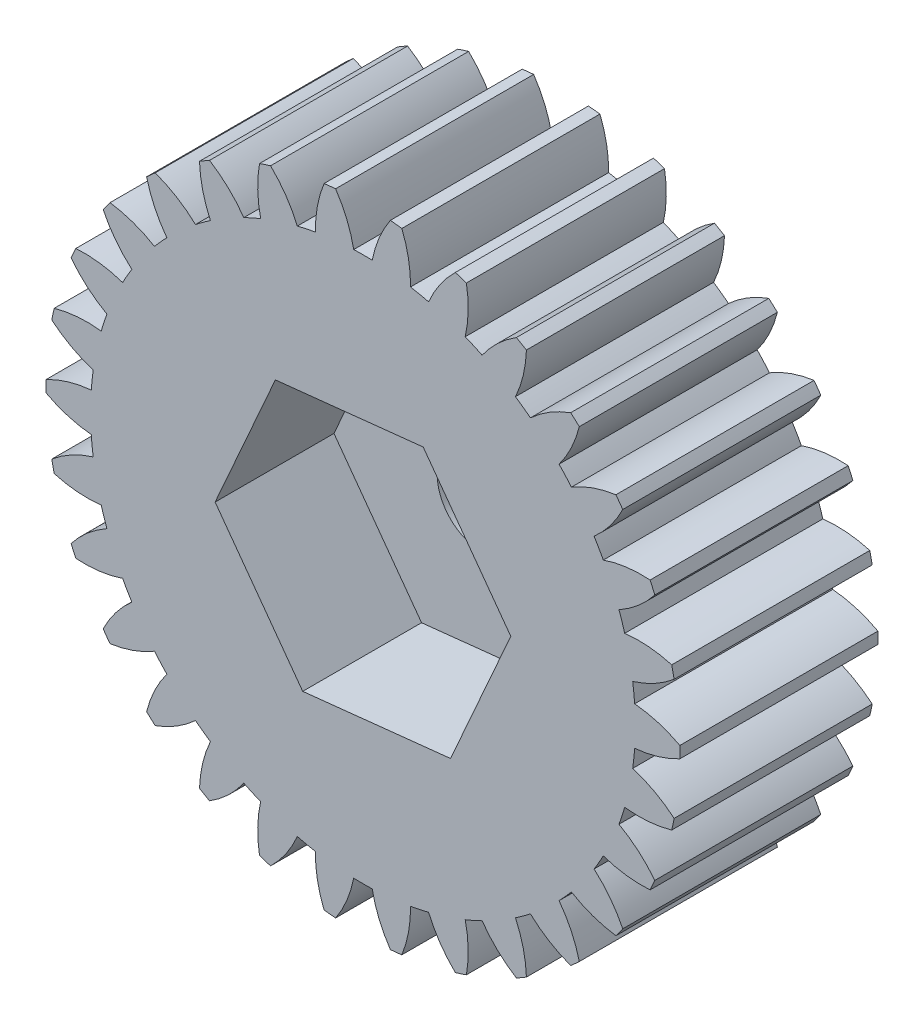
from build123d import *

# Parameters (mm, degrees)
BOSS_EXTRUDE1_DEPTH = 10
SKETCH2_R           = 2.25
CUT_EXTRUDE1_DEPTH  = 10
CUT_EXTRUDE2_DEPTH  = 6


with BuildPart() as part:
    # Sketch1 → Boss-Extrude1 (new body)
    with BuildSketch(Plane.XY):
        with BuildLine():
            ThreePointArc((13.714564017, 1.835617176), (14.890017219, 2.061122256), (15.997323333, 2.515452466))
            ThreePointArc((15.997323333, 2.515452466), (16, 2.808106158), (15.997323333, 3.10075985))
            ThreePointArc((15.997323333, 3.10075985), (14.890017219, 3.555090061), (13.714564017, 3.78059514))
            ThreePointArc((13.714564017, 3.78059514), (13.673681539, 4.245268), (13.617059717, 4.708286587))
            ThreePointArc((13.617059717, 4.708286587), (14.719941304, 5.173254302), (15.70858956, 5.847878195))
            ThreePointArc((15.70858956, 5.847878195), (15.650361612, 6.134693211), (15.586897312, 6.420395207))
            ThreePointArc((15.586897312, 6.420395207), (14.409327931, 6.634575326), (13.21267606, 6.610762116))
            ThreePointArc((13.21267606, 6.610762116), (13.076076043, 7.056780814), (12.924424565, 7.497908996))
            ThreePointArc((12.924424565, 7.497908996), (13.90653332, 8.182018026), (14.733315045, 9.047451298))
            ThreePointArc((14.733315045, 9.047451298), (14.616727322, 9.315892447), (14.495249085, 9.582156199))
            ThreePointArc((14.495249085, 9.582156199), (13.29888187, 9.546825528), (12.133330757, 9.27473478))
            ThreePointArc((12.133330757, 9.27473478), (11.906983277, 9.682606158), (11.666930042, 10.082564516))
            ThreePointArc((11.666930042, 10.082564516), (12.485343098, 10.955916014), (13.114123965, 11.974335079))
            ThreePointArc((13.114123965, 11.974335079), (12.94427191, 12.212670195), (12.770088917, 12.447858699))
            ThreePointArc((12.770088917, 12.447858699), (11.607210855, 12.164561357), (10.523700679, 11.656084742))
            ThreePointArc((10.523700679, 11.656084742), (10.217498205, 12.007982865), (9.899534691, 12.349291299))
            ThreePointArc((9.899534691, 12.349291299), (10.518483472, 13.373715614), (10.921782738, 14.500610672))
            ThreePointArc((10.921782738, 14.500610672), (10.706089702, 14.698423366), (10.486814585, 14.892257757))
            ThreePointArc((10.486814585, 14.892257757), (9.408249029, 14.373375197), (8.454134382, 13.650735583))
            ThreePointArc((8.454134382, 13.650735583), (8.081459434, 13.931280814), (7.699482172, 14.199022508))
            ThreePointArc((7.699482172, 14.199022508), (8.091915645, 15.329747381), (8.252107198, 16.515867711))
            ThreePointArc((8.252107198, 16.515867711), (8, 16.664512619), (7.745216135, 16.808521403))
            ThreePointArc((7.745216135, 16.808521403), (6.798101574, 16.076731284), (6.015081845, 15.17151149))
            ThreePointArc((6.015081845, 15.17151149), (5.592222106, 15.368442655), (5.162925335, 15.550916013))
            ThreePointArc((5.162925335, 15.550916013), (5.311692275, 16.738523342), (5.221774975, 17.932029793))
            ThreePointArc((5.221774975, 17.932029793), (4.94427191, 18.025010419), (4.665114574, 18.112899721))
            ThreePointArc((4.665114574, 18.112899721), (3.890844459, 17.200184782), (3.313141369, 16.151947257))
            ThreePointArc((3.313141369, 16.151947257), (2.858577837, 16.256657521), (2.400723887, 16.34588758))
            ThreePointArc((2.400723887, 16.34588758), (2.299322464, 17.538473225), (1.963226128, 18.687203839))
            ThreePointArc((1.963226128, 18.687203839), (1.672455412, 18.720456484), (1.38112512, 18.748385121))
            ThreePointArc((1.38112512, 18.748385121), (0.813538771, 17.694635384), (0.466400716, 16.549193137))
            ThreePointArc((0.466400716, 16.549193137), (0, 16.557106158), (-0.466400716, 16.549193137))
            ThreePointArc((-0.466400716, 16.549193137), (-0.813538771, 17.694635384), (-1.38112512, 18.748385121))
            ThreePointArc((-1.38112512, 18.748385121), (-1.672455412, 18.720456484), (-1.963226128, 18.687203839))
            ThreePointArc((-1.963226128, 18.687203839), (-2.299322464, 17.538473225), (-2.400723887, 16.34588758))
            ThreePointArc((-2.400723887, 16.34588758), (-2.858577837, 16.256657521), (-3.313141369, 16.151947257))
            ThreePointArc((-3.313141369, 16.151947257), (-3.890844459, 17.200184782), (-4.665114574, 18.112899721))
            ThreePointArc((-4.665114574, 18.112899721), (-4.94427191, 18.025010419), (-5.221774975, 17.932029793))
            ThreePointArc((-5.221774975, 17.932029793), (-5.311692275, 16.738523342), (-5.162925335, 15.550916013))
            ThreePointArc((-5.162925335, 15.550916013), (-5.592222106, 15.368442655), (-6.015081845, 15.17151149))
            ThreePointArc((-6.015081845, 15.17151149), (-6.798101574, 16.076731284), (-7.745216135, 16.808521403))
            ThreePointArc((-7.745216135, 16.808521403), (-8, 16.664512619), (-8.252107198, 16.515867711))
            ThreePointArc((-8.252107198, 16.515867711), (-8.091915645, 15.329747381), (-7.699482172, 14.199022508))
            ThreePointArc((-7.699482172, 14.199022508), (-8.081459434, 13.931280814), (-8.454134382, 13.650735583))
            ThreePointArc((-8.454134382, 13.650735583), (-9.408249029, 14.373375197), (-10.486814585, 14.892257757))
            ThreePointArc((-10.486814585, 14.892257757), (-10.706089702, 14.698423366), (-10.921782738, 14.500610672))
            ThreePointArc((-10.921782738, 14.500610672), (-10.518483472, 13.373715614), (-9.899534691, 12.349291299))
            ThreePointArc((-9.899534691, 12.349291299), (-10.217498205, 12.007982865), (-10.523700679, 11.656084742))
            ThreePointArc((-10.523700679, 11.656084742), (-11.607210855, 12.164561357), (-12.770088917, 12.447858699))
            ThreePointArc((-12.770088917, 12.447858699), (-12.94427191, 12.212670195), (-13.114123965, 11.974335079))
            ThreePointArc((-13.114123965, 11.974335079), (-12.485343098, 10.955916014), (-11.666930042, 10.082564516))
            ThreePointArc((-11.666930042, 10.082564516), (-11.906983277, 9.682606158), (-12.133330757, 9.27473478))
            ThreePointArc((-12.133330757, 9.27473478), (-13.29888187, 9.546825528), (-14.495249085, 9.582156199))
            ThreePointArc((-14.495249085, 9.582156199), (-14.616727322, 9.315892447), (-14.733315045, 9.047451298))
            ThreePointArc((-14.733315045, 9.047451298), (-13.90653332, 8.182018026), (-12.924424565, 7.497908996))
            ThreePointArc((-12.924424565, 7.497908996), (-13.076076043, 7.056780814), (-13.21267606, 6.610762116))
            ThreePointArc((-13.21267606, 6.610762116), (-14.409327931, 6.634575326), (-15.586897312, 6.420395207))
            ThreePointArc((-15.586897312, 6.420395207), (-15.650361612, 6.134693211), (-15.70858956, 5.847878195))
            ThreePointArc((-15.70858956, 5.847878195), (-14.719941304, 5.173254302), (-13.617059717, 4.708286587))
            ThreePointArc((-13.617059717, 4.708286587), (-13.673681539, 4.245268), (-13.714564017, 3.78059514))
            ThreePointArc((-13.714564017, 3.78059514), (-14.890017219, 3.555090061), (-15.997323333, 3.10075985))
            ThreePointArc((-15.997323333, 3.10075985), (-16, 2.808106158), (-15.997323333, 2.515452466))
            ThreePointArc((-15.997323333, 2.515452466), (-14.890017219, 2.061122256), (-13.714564017, 1.835617176))
            ThreePointArc((-13.714564017, 1.835617176), (-13.673681539, 1.370944317), (-13.617059717, 0.907925729))
            ThreePointArc((-13.617059717, 0.907925729), (-14.719941304, 0.442958014), (-15.70858956, -0.231665878))
            ThreePointArc((-15.70858956, -0.231665878), (-15.650361612, -0.518480895), (-15.586897312, -0.804182891))
            ThreePointArc((-15.586897312, -0.804182891), (-14.409327931, -1.01836301), (-13.21267606, -0.9945498))
            ThreePointArc((-13.21267606, -0.9945498), (-13.076076043, -1.440568498), (-12.924424565, -1.881696679))
            ThreePointArc((-12.924424565, -1.881696679), (-13.90653332, -2.56580571), (-14.733315045, -3.431238982))
            ThreePointArc((-14.733315045, -3.431238982), (-14.616727322, -3.699680131), (-14.495249085, -3.965943883))
            ThreePointArc((-14.495249085, -3.965943883), (-13.29888187, -3.930613212), (-12.133330757, -3.658522463))
            ThreePointArc((-12.133330757, -3.658522463), (-11.906983277, -4.066393842), (-11.666930042, -4.4663522))
            ThreePointArc((-11.666930042, -4.4663522), (-12.485343098, -5.339703698), (-13.114123965, -6.358122763))
            ThreePointArc((-13.114123965, -6.358122763), (-12.94427191, -6.596457879), (-12.770088917, -6.831646383))
            ThreePointArc((-12.770088917, -6.831646383), (-11.607210855, -6.548349041), (-10.523700679, -6.039872426))
            ThreePointArc((-10.523700679, -6.039872426), (-10.217498205, -6.391770549), (-9.899534691, -6.733078983))
            ThreePointArc((-9.899534691, -6.733078983), (-10.518483472, -7.757503298), (-10.921782738, -8.884398356))
            ThreePointArc((-10.921782738, -8.884398356), (-10.706089702, -9.08221105), (-10.486814585, -9.27604544))
            ThreePointArc((-10.486814585, -9.27604544), (-9.408249029, -8.757162881), (-8.454134382, -8.034523267))
            ThreePointArc((-8.454134382, -8.034523267), (-8.081459434, -8.315068498), (-7.699482172, -8.582810192))
            ThreePointArc((-7.699482172, -8.582810192), (-8.091915645, -9.713535065), (-8.252107198, -10.899655395))
            ThreePointArc((-8.252107198, -10.899655395), (-8, -11.048300302), (-7.745216135, -11.192309087))
            ThreePointArc((-7.745216135, -11.192309087), (-6.798101574, -10.460518968), (-6.015081845, -9.555299173))
            ThreePointArc((-6.015081845, -9.555299173), (-5.592222106, -9.752230339), (-5.162925335, -9.934703696))
            ThreePointArc((-5.162925335, -9.934703696), (-5.311692275, -11.122311025), (-5.221774975, -12.315817477))
            ThreePointArc((-5.221774975, -12.315817477), (-4.94427191, -12.408798103), (-4.665114574, -12.496687405))
            ThreePointArc((-4.665114574, -12.496687405), (-3.890844459, -11.583972466), (-3.313141369, -10.535734941))
            ThreePointArc((-3.313141369, -10.535734941), (-2.858577837, -10.640445204), (-2.400723887, -10.729675264))
            ThreePointArc((-2.400723887, -10.729675264), (-2.299322464, -11.922260909), (-1.963226128, -13.070991523))
            ThreePointArc((-1.963226128, -13.070991523), (-1.672455412, -13.104244168), (-1.38112512, -13.132172804))
            ThreePointArc((-1.38112512, -13.132172804), (-0.813538771, -12.078423068), (-0.466400716, -10.932980821))
            ThreePointArc((-0.466400716, -10.932980821), (0, -10.940893842), (0.466400716, -10.932980821))
            ThreePointArc((0.466400716, -10.932980821), (0.813538771, -12.078423068), (1.38112512, -13.132172804))
            ThreePointArc((1.38112512, -13.132172804), (1.672455412, -13.104244168), (1.963226128, -13.070991523))
            ThreePointArc((1.963226128, -13.070991523), (2.299322464, -11.922260909), (2.400723887, -10.729675264))
            ThreePointArc((2.400723887, -10.729675264), (2.858577837, -10.640445204), (3.313141369, -10.535734941))
            ThreePointArc((3.313141369, -10.535734941), (3.890844459, -11.583972466), (4.665114574, -12.496687405))
            ThreePointArc((4.665114574, -12.496687405), (4.94427191, -12.408798103), (5.221774975, -12.315817477))
            ThreePointArc((5.221774975, -12.315817477), (5.311692275, -11.122311025), (5.162925335, -9.934703696))
            ThreePointArc((5.162925335, -9.934703696), (5.592222106, -9.752230339), (6.015081845, -9.555299173))
            ThreePointArc((6.015081845, -9.555299173), (6.798101574, -10.460518968), (7.745216135, -11.192309087))
            ThreePointArc((7.745216135, -11.192309087), (8, -11.048300302), (8.252107198, -10.899655395))
            ThreePointArc((8.252107198, -10.899655395), (8.091915645, -9.713535065), (7.699482172, -8.582810192))
            ThreePointArc((7.699482172, -8.582810192), (8.081459434, -8.315068498), (8.454134382, -8.034523267))
            ThreePointArc((8.454134382, -8.034523267), (9.408249029, -8.757162881), (10.486814585, -9.27604544))
            ThreePointArc((10.486814585, -9.27604544), (10.706089702, -9.08221105), (10.921782738, -8.884398356))
            ThreePointArc((10.921782738, -8.884398356), (10.518483472, -7.757503298), (9.899534691, -6.733078983))
            ThreePointArc((9.899534691, -6.733078983), (10.217498205, -6.391770549), (10.523700679, -6.039872426))
            ThreePointArc((10.523700679, -6.039872426), (11.607210855, -6.548349041), (12.770088917, -6.831646383))
            ThreePointArc((12.770088917, -6.831646383), (12.94427191, -6.596457879), (13.114123965, -6.358122763))
            ThreePointArc((13.114123965, -6.358122763), (12.485343098, -5.339703698), (11.666930042, -4.4663522))
            ThreePointArc((11.666930042, -4.4663522), (11.906983277, -4.066393842), (12.133330757, -3.658522463))
            ThreePointArc((12.133330757, -3.658522463), (13.29888187, -3.930613212), (14.495249085, -3.965943883))
            ThreePointArc((14.495249085, -3.965943883), (14.616727322, -3.699680131), (14.733315045, -3.431238982))
            ThreePointArc((14.733315045, -3.431238982), (13.90653332, -2.56580571), (12.924424565, -1.881696679))
            ThreePointArc((12.924424565, -1.881696679), (13.076076043, -1.440568498), (13.21267606, -0.9945498))
            ThreePointArc((13.21267606, -0.9945498), (14.409327931, -1.01836301), (15.586897312, -0.804182891))
            ThreePointArc((15.586897312, -0.804182891), (15.650361612, -0.518480895), (15.70858956, -0.231665878))
            ThreePointArc((15.70858956, -0.231665878), (14.719941304, 0.442958014), (13.617059717, 0.907925729))
            ThreePointArc((13.617059717, 0.907925729), (13.673681539, 1.370944317), (13.714564017, 1.835617176))
        make_face()
    extrude(amount=BOSS_EXTRUDE1_DEPTH)

    # Sketch2 → Cut-Extrude1 (cut)
    with BuildSketch(Plane(origin=(0, 0, 0), x_dir=(-1, 0, 0), z_dir=(0, 0, -1))):
        with Locations((0, 2.808106158)):
            Circle(SKETCH2_R)
    extrude(amount=-CUT_EXTRUDE1_DEPTH, mode=Mode.SUBTRACT)

    # Sketch3 → Cut-Extrude2 (cut)
    with BuildSketch(Plane.XY.offset(10)):
        Polygon((3.041355434, 9.669847224), (7.463119794, 3.605085623), (4.42176436, -3.256655443), (-3.041355434, -4.053634908), (-7.463119794, 2.011126693), (-4.42176436, 8.872867759), align=None)
    extrude(amount=-CUT_EXTRUDE2_DEPTH, mode=Mode.SUBTRACT)


solid = part.part
